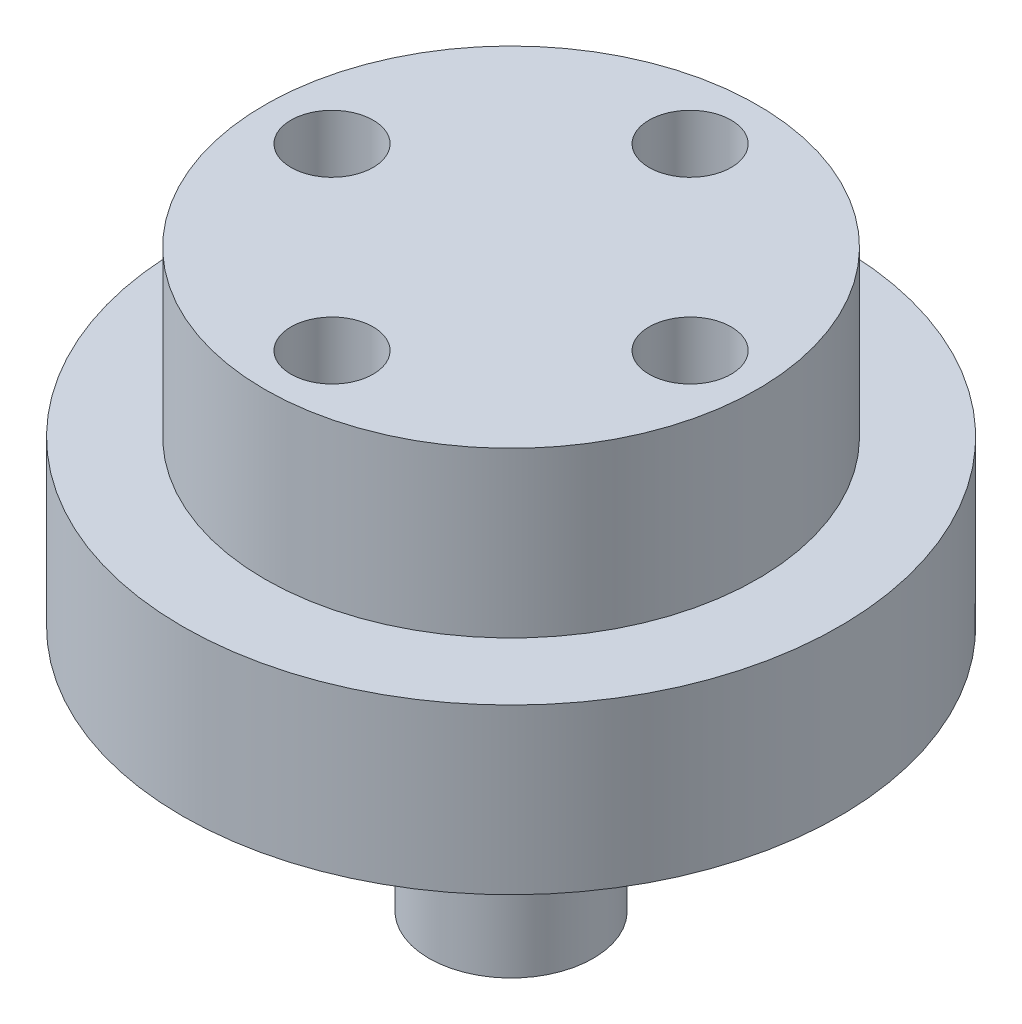
from build123d import *

# Parameters (mm, degrees)
SKETCH1_R           = 101.6
BOSS_EXTRUDE1_DEPTH = 50.8
SKETCH2_R           = 76.2
BOSS_EXTRUDE2_DEPTH = 50.8
SKETCH3_R           = 12.7
CUT_EXTRUDE1_DEPTH  = 176.976362049
SKETCH4_R           = 25.4
BOSS_EXTRUDE3_DEPTH = 76.2


with BuildPart() as part:
    # Sketch1 → Boss-Extrude1 (new body)
    with BuildSketch(Plane(origin=(0, 0, 0), x_dir=(1, 0, 0), z_dir=(0, 1, 0))):
        with Locations(Location((0, 0, 0), (0, 0, 270))):
            Circle(SKETCH1_R)
    extrude(amount=BOSS_EXTRUDE1_DEPTH)

    # Sketch2 → Boss-Extrude2 (add)
    with BuildSketch(Plane(origin=(0, 50.8, 0), x_dir=(1, 0, 0), z_dir=(0, 1, 0))):
        with Locations(Location((0, 0, 0), (0, 0, 270))):
            Circle(SKETCH2_R)
    extrude(amount=BOSS_EXTRUDE2_DEPTH)

    # Sketch3 → Cut-Extrude1 (cut, through all)
    with BuildSketch(Plane(origin=(0, 101.6, 0), x_dir=(1, 0, 0), z_dir=(0, 1, 0))):
        with Locations(Location((0, 55.372, 0), (0, 0, 270))):
            Circle(SKETCH3_R)
        with Locations(Location((-55.372, 0, 0), (0, 0, 270))):
            Circle(SKETCH3_R)
        with Locations(Location((0, -55.372, 0), (0, 0, 270))):
            Circle(SKETCH3_R)
        with Locations(Location((55.372, 0, 0), (0, 0, 270))):
            Circle(SKETCH3_R)
    extrude(amount=-CUT_EXTRUDE1_DEPTH, mode=Mode.SUBTRACT)

    # Sketch4 → Boss-Extrude3 (add)
    with BuildSketch(Plane.XZ):
        with Locations(Location((0, 0, 0), (0, 0, 90))):
            Circle(SKETCH4_R)
    extrude(amount=BOSS_EXTRUDE3_DEPTH)


solid = part.part
